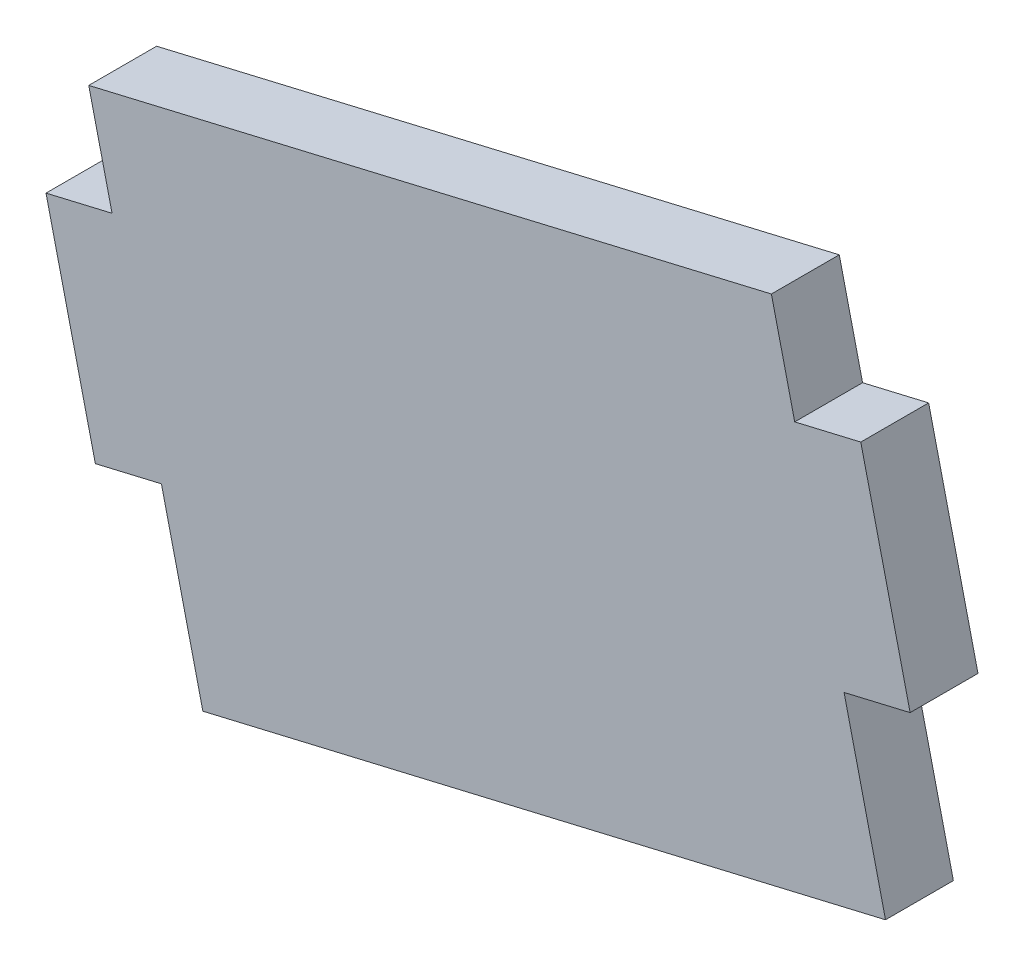
from build123d import *

# Parameters (mm, degrees)
BASE_EXTRUDE_DEPTH = 3


with BuildPart() as part:
    # Sketch1 → Base-Extrude (new body)
    with BuildSketch(Plane.XY):
        Polygon((643.040286555, 392.206492508), (642.009299198, 396.586796729), (611.833870118, 389.484439386), (612.864857475, 385.104135165), (609.94465466, 384.41681026), (612.12576569, 375.15003333), (615.045968504, 375.837358234), (616.878834915, 368.05015073), (647.054263995, 375.152508073), (645.221397584, 382.939715578), (648.141600398, 383.627040482), (645.960489369, 392.893817412), align=None)
    extrude(amount=BASE_EXTRUDE_DEPTH)


solid = part.part
